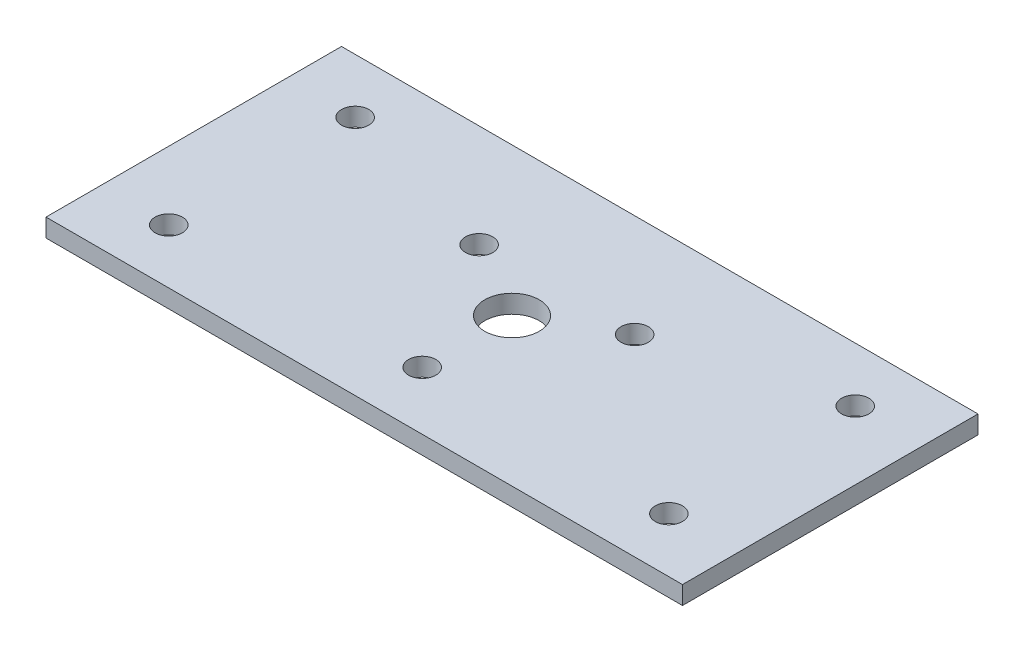
from build123d import *

# Parameters (mm, degrees)
SKETCH1_W           = 140
SKETCH1_H           = 65
SKETCH1_R           = 6
SKETCH1_R_2         = 3
BOSS_EXTRUDE1_DEPTH = 4


with BuildPart() as part:
    # Sketch1 → Boss-Extrude1 (new body)
    with BuildSketch(Plane(origin=(0, 0, 0), x_dir=(1, 0, 0), z_dir=(0, 1, 0))):
        Rectangle(SKETCH1_W, SKETCH1_H)
        Circle(SKETCH1_R, mode=Mode.SUBTRACT)
        with Locations((0, -19.75)):
            Circle(SKETCH1_R_2, mode=Mode.SUBTRACT)
        with Locations((-17.104001725, 9.875)):
            Circle(SKETCH1_R_2, mode=Mode.SUBTRACT)
        with Locations((17.104001725, 9.875)):
            Circle(SKETCH1_R_2, mode=Mode.SUBTRACT)
        with Locations((-55, 20.5)):
            Circle(SKETCH1_R_2, mode=Mode.SUBTRACT)
        with Locations((-55, -20.5)):
            Circle(SKETCH1_R_2, mode=Mode.SUBTRACT)
        with Locations((55, 20.5)):
            Circle(SKETCH1_R_2, mode=Mode.SUBTRACT)
        with Locations((55, -20.5)):
            Circle(SKETCH1_R_2, mode=Mode.SUBTRACT)
    extrude(amount=BOSS_EXTRUDE1_DEPTH)


solid = part.part
